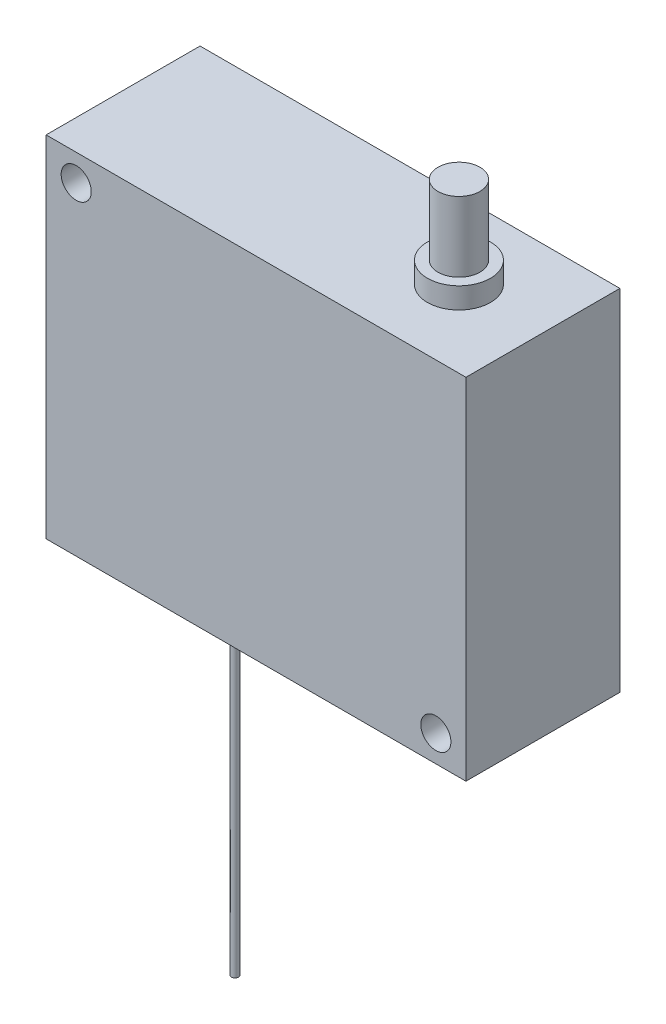
from build123d import *

# Parameters (mm, degrees)
SKETCH_1_W          = 60
SKETCH_1_H          = 50
EXTRUDE_1_DEPTH     = 22
SKETCH_2_R          = 4.5
EXTRUDE_2_DEPTH     = 3
SKETCH_3_R          = 3
EXTRUDE_3_DEPTH     = 10
SKETCH_4_R          = 0.5
EXTRUDE_4_DEPTH     = 55
SKETCH_5_W          = 39
SKETCH_5_H          = 8
CUT_EXTRUDE_1_DEPTH = 0.01
SKETCH_6_R          = 2.15
CUT_EXTRUDE_2_DEPTH = 90.738509014


with BuildPart() as part:
    # 草图1 → 凸台-拉伸1 (new body)
    with BuildSketch(Plane.XY):
        with Locations((30, 25)):
            Rectangle(SKETCH_1_W, SKETCH_1_H)
    extrude(amount=EXTRUDE_1_DEPTH)

    # 草图2 → 凸台-拉伸2 (add)
    with BuildSketch(Plane(origin=(0, 50, 0), x_dir=(1, 0, 0), z_dir=(0, 1, 0))):
        with Locations(Location((48, -11, 0), (0, 0, 90))):
            Circle(SKETCH_2_R)
    extrude(amount=EXTRUDE_2_DEPTH)

    # 草图3 → 凸台-拉伸3 (add)
    with BuildSketch(Plane(origin=(0, 53, 0), x_dir=(1, 0, 0), z_dir=(0, 1, 0))):
        with Locations(Location((48, -11, 0), (0, 0, 270))):
            Circle(SKETCH_3_R)
    extrude(amount=EXTRUDE_3_DEPTH)

    # 草图4 → 凸台-拉伸4 (add)
    with BuildSketch(Plane.XZ):
        with Locations(Location((12.5, 7.5, 0), (0, 0, 90))):
            Circle(SKETCH_4_R)
    extrude(amount=EXTRUDE_4_DEPTH)

    # 草图5 → 切除-拉伸1 (cut)
    with BuildSketch(Plane.XZ):
        with Locations((22.5, 7.5)):
            Rectangle(SKETCH_5_W, SKETCH_5_H)
    extrude(amount=-CUT_EXTRUDE_1_DEPTH, mode=Mode.SUBTRACT)


with BuildPart() as cut_extrude_1_piece_1:
    # of the separate pieces the step leaves, piece 1, a body of its own (cut_extrude_1_pieces)
    add(part.part.solids().sort_by_distance((0, 0, 0))[0])

    # 草图6 → 切除-拉伸2 (cut, through all)
    with BuildSketch(Plane.XY.offset(22)):
        with Locations((55.7, 3.8)):
            Circle(SKETCH_6_R)
        with Locations((4.3, 46.2)):
            Circle(SKETCH_6_R)
    extrude(amount=-CUT_EXTRUDE_2_DEPTH, mode=Mode.SUBTRACT)


with BuildPart() as cut_extrude_1_piece_2:
    # of the separate pieces the step leaves, piece 2, a body of its own (cut_extrude_1_pieces)
    add(part.part.solids().sort_by_distance((12.5, 0, 8))[0])


solid = Compound([cut_extrude_1_piece_1.part, cut_extrude_1_piece_2.part])
